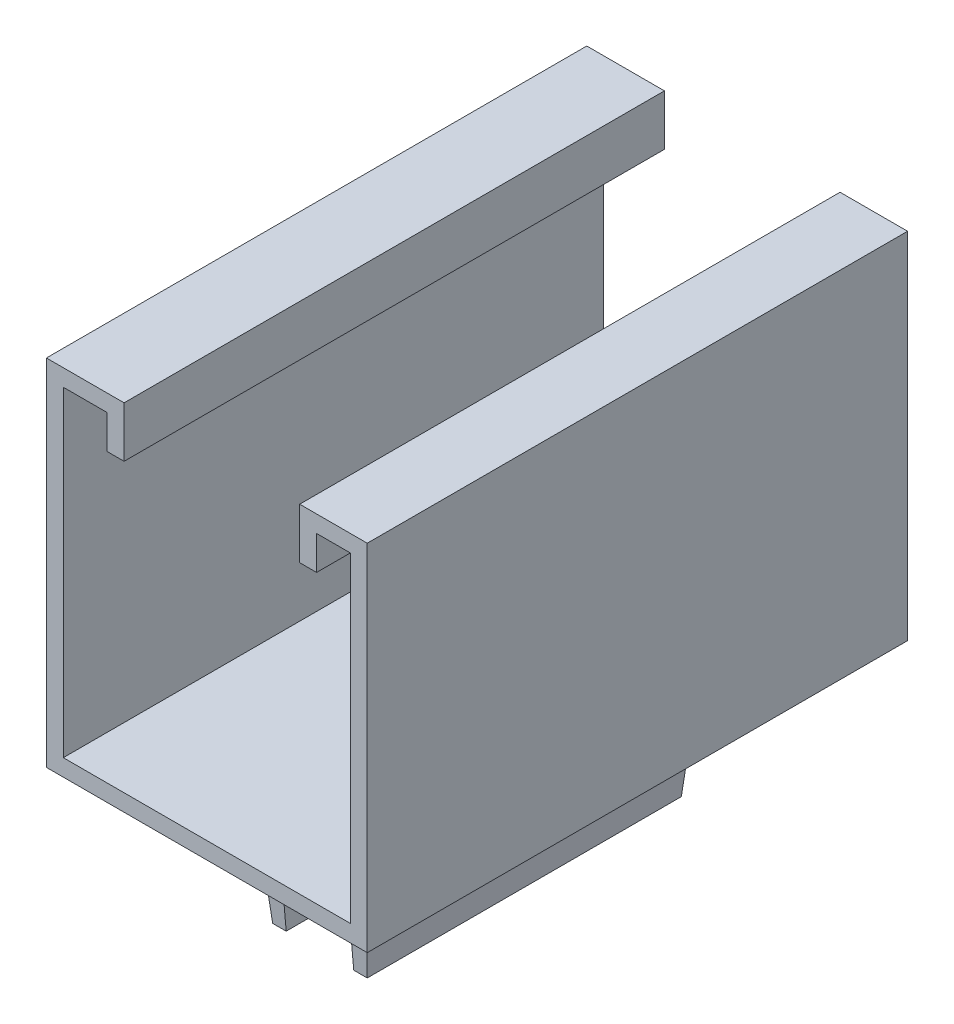
from build123d import *

# Parameters (mm, degrees)
BOSS_EXTRUDE1_DEPTH     = 101.6
SKETCH2_W               = 22.225
SKETCH2_H               = 63.5
BOSS_EXTRUDE2_DEPTH     = 25.4
BOSS_EXTRUDE2_TAPER     = 5
SKETCH2_3_W             = 12.7
SKETCH2_3_H             = 63.5
CUT_EXTRUDE1_DEPTH      = 25.4
CUT_EXTRUDE2_DEPTH      = 140.85325407
CUT_EXTRUDE2_DEPTH_BACK = 140.85325407
SKETCH3_R               = 3.175


with BuildPart() as part:
    # Sketch1 → Boss-Extrude1 (new body)
    with BuildSketch(Plane.XY):
        Polygon((0, 0), (0, -60.325), (53.975, -60.325), (53.975, 0), (47.625, 0), (47.625, -6.35), (44.45, -6.35), (44.45, 3.175), (57.15, 3.175), (57.15, -63.5), (-3.175, -63.5), (-3.175, 3.175), (11.43, 3.175), (11.43, -6.35), (8.255, -6.35), (8.255, 0), align=None)
    extrude(amount=BOSS_EXTRUDE1_DEPTH)

    # Sketch2 → Boss-Extrude2 (add)
    with BuildSketch(Plane(origin=(0, -63.5, 0), x_dir=(-1, 0, 0), z_dir=(0, -1, 0))):
        with Locations((-26.9875, -50.8)):
            Rectangle(SKETCH2_W, SKETCH2_H)
    extrude(amount=BOSS_EXTRUDE2_DEPTH, taper=BOSS_EXTRUDE2_TAPER)

    # Sketch2<3> → Cut-Extrude1 (cut)
    with BuildSketch(Plane(origin=(0, -63.5, 0), x_dir=(-1, 0, 0), z_dir=(0, -1, 0))):
        with Locations((-26.9875, -50.8)):
            Rectangle(SKETCH2_3_W, SKETCH2_3_H)
    extrude(amount=CUT_EXTRUDE1_DEPTH, mode=Mode.SUBTRACT)

    # Sketch3 → Cut-Extrude2 (cut, two sides: drawn at the far end of the back side and taken through both)
    with BuildSketch(Plane(origin=(20.6375, 0, 0), x_dir=(0, 0, -1), z_dir=(1, 0, 0)).offset(-CUT_EXTRUDE2_DEPTH_BACK)):
        with Locations(Location((-66.119446987, -76.2, 0), (0, 0, 270))):
            Circle(SKETCH3_R)
        with Locations(Location((-35.480553013, -76.2, 0), (0, 0, 270))):
            Circle(SKETCH3_R)
    extrude(amount=CUT_EXTRUDE2_DEPTH + CUT_EXTRUDE2_DEPTH_BACK, mode=Mode.SUBTRACT)


solid = part.part
